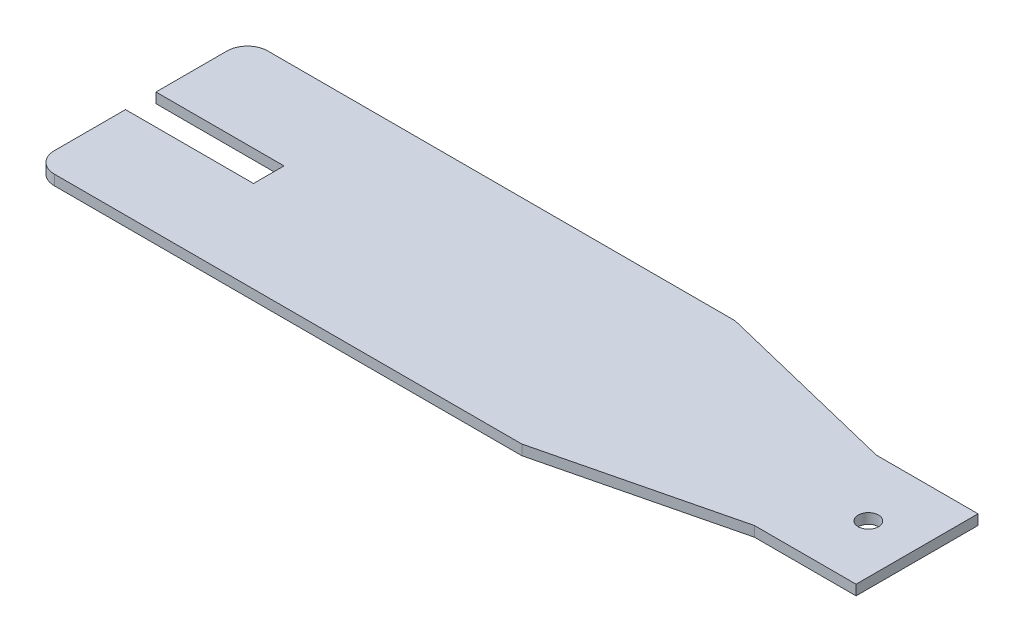
from build123d import *

# Parameters (mm, degrees)
SKETCH1_R           = 5
BOSS_EXTRUDE1_DEPTH = 5


with BuildPart() as part:
    # Sketch1 → Boss-Extrude1 (new body)
    with BuildSketch(Plane(origin=(0, 0, 0), x_dir=(1, 0, 0), z_dir=(0, 1, 0))):
        with BuildLine():
            Line((49, -62.104477612), (-181, -62.104477612))
            ThreePointArc((-181, -62.104477612), (-188.071067812, -59.175545424), (-191, -52.104477612))
            Line((-191, -52.104477612), (-191, -17.104477612))
            Line((-191, -17.104477612), (-128, -17.104477612))
            Line((-128, -17.104477612), (-128, -2.104477612))
            Line((-128, -2.104477612), (-191, -2.104477612))
            Line((-191, -2.104477612), (-191, 32.895522388))
            ThreePointArc((-191, 32.895522388), (-188.071067812, 39.9665902), (-181, 42.895522388))
            Line((-181, 42.895522388), (49, 42.895522388))
            Line((49, 42.895522388), (141, 20.395522388))
            Line((141, 20.395522388), (191, 20.395522388))
            Line((191, 20.395522388), (191, -39.604477612))
            Line((191, -39.604477612), (141, -39.604477612))
            Line((141, -39.604477612), (49, -62.104477612))
        make_face()
        with Locations(Location((167.053731343, -9.604477612, 0), (0, 0, 270))):
            Circle(SKETCH1_R, mode=Mode.SUBTRACT)
    extrude(amount=BOSS_EXTRUDE1_DEPTH)


solid = part.part
